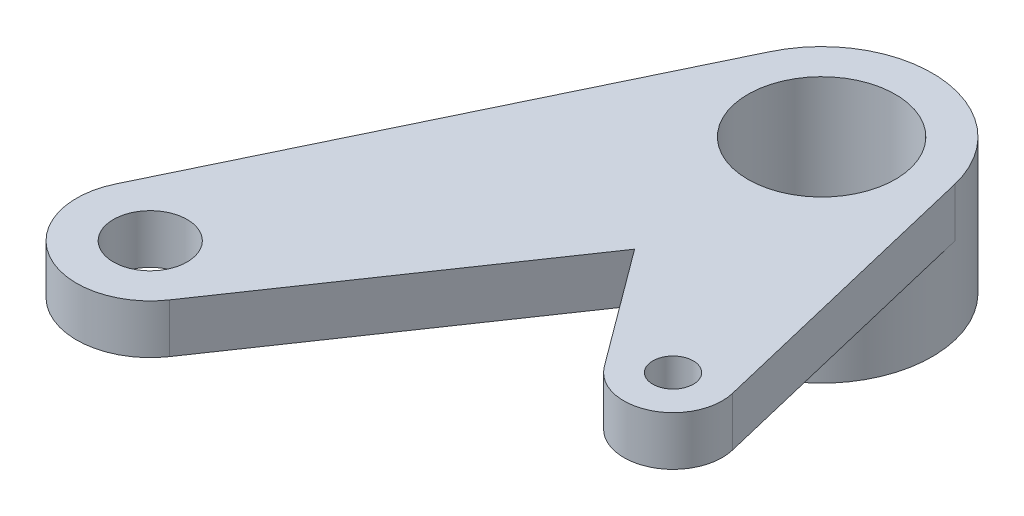
from build123d import *
from build123d.topology import SkipClean

# Parameters (mm, degrees)
EXTRUDE_1_DEPTH     = 4
EXTRUDE_START       = -11
SKETCH_3_R          = 9
EXTRUDE_2_DEPTH     = 11
SKETCH_4_R          = 3
CUT_EXTRUDE_1_DEPTH = 50.484262082
HOLE_WIZARD_M4_1_D  = 3.3
SKETCH_10_R         = 6
CUT_EXTRUDE_2_DEPTH = 10
SKETCH_11_R         = 5.5
CUT_EXTRUDE_3_DEPTH = 50.484262082
SCALE1_SCALE        = 2


with BuildPart() as part:
    # 草图1 → 凸台-拉伸1 (new body)
    with BuildSketch(Plane(origin=(0, 0, 0), x_dir=(1, 0, 0), z_dir=(0, 1, 0))):
        with BuildLine():
            Line((-8.109776452, 3.902758754), (-25.406517635, -32.039176982))
            ThreePointArc((-25.406517635, -32.039176982), (-23, -39.837168574), (-15.043482365, -38.022278184))
            Line((-15.043482365, -38.022278184), (0.302963304, -15.526261061))
            Line((0.302963304, -15.526261061), (7.351564548, -25.039059461))
            ThreePointArc((7.351564548, -25.039059461), (12.25592959, -26.282925824), (14.455537758, -21.72642235))
            Line((14.455537758, -21.72642235), (8.752682732, 2.095362733))
            ThreePointArc((8.752682732, 2.095362733), (0.95916746, 8.948742805), (-8.109776452, 3.902758754))
        make_face()
    extrude(amount=EXTRUDE_1_DEPTH)

    # 草图3 → 凸台-拉伸2 (add)
    with SkipClean():  # the faces are left unmerged after this step: merging them gives an invalid solid
        with BuildSketch(Plane(origin=(0, 4, 0), x_dir=(1, 0, 0), z_dir=(0, 1, 0)).offset(EXTRUDE_START)):
            with Locations(Location((0, 0, 0), (0, 0, 154.301222305))):
                Circle(SKETCH_3_R)
        extrude(amount=EXTRUDE_2_DEPTH)

    # 草图4 → 切除-拉伸1 (cut, through all)
    with SkipClean():  # the faces are left unmerged after this step: merging them gives an invalid solid
        with BuildSketch(Plane(origin=(0, 4, 0), x_dir=(1, 0, 0), z_dir=(0, 1, 0))):
            with Locations(Location((-20, -34.641016151, 0), (0, 0, 270))):
                Circle(SKETCH_4_R)
        extrude(amount=-CUT_EXTRUDE_1_DEPTH, mode=Mode.SUBTRACT)

    # M4 螺纹孔1 (through all)
    with Locations(Plane(origin=(0, 4, 0), x_dir=(1, 0, 0), z_dir=(0, 1, 0))):
        with Locations((10.565456544, -22.657694676)):
            Hole(HOLE_WIZARD_M4_1_D / 2)

    # 草图10 → 切除-拉伸2 (cut)
    with SkipClean():  # the faces are left unmerged after this step: merging them gives an invalid solid
        with BuildSketch(Plane(origin=(0, 4, 0), x_dir=(1, 0, 0), z_dir=(0, 1, 0))):
            with Locations(Location((0, 0, 0), (0, 0, 270))):
                Circle(SKETCH_10_R)
        extrude(amount=-CUT_EXTRUDE_2_DEPTH, mode=Mode.SUBTRACT)

    # 草图11 → 切除-拉伸3 (cut, through all)
    with SkipClean():  # the faces are left unmerged after this step: merging them gives an invalid solid
        with BuildSketch(Plane.XZ.offset(7)):
            with Locations(Location((0, 0, 0), (0, 0, 270))):
                Circle(SKETCH_11_R)
        extrude(amount=-CUT_EXTRUDE_3_DEPTH, mode=Mode.SUBTRACT)


with BuildPart() as part_1:
    # Scale1: scaled about (-4.168101576, 0.704724682, 12.285042226)
    add(part.part.scale(SCALE1_SCALE).moved(Location((4.168101576, -0.704724682, -12.285042226))))


solid = part_1.part
